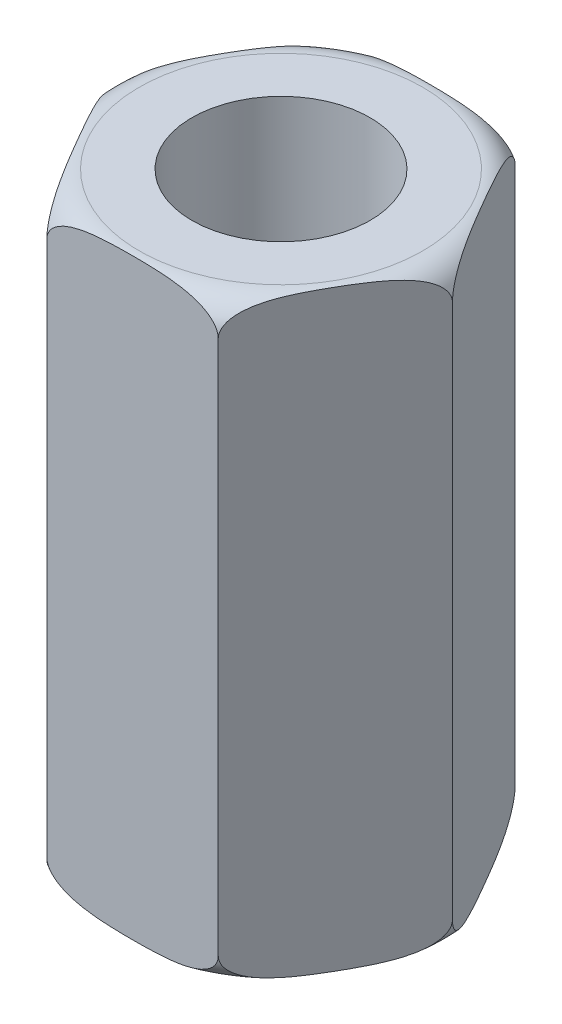
from build123d import *

# Parameters (mm, degrees)
ESQUISSE1_R        = 1.5
BOSS_EXTRU_1_DEPTH = 10


with BuildPart() as part:
    # Esquisse1 → Boss.-Extru.1 (new body)
    with BuildSketch(Plane(origin=(0, 0, 0), x_dir=(1, 0, 0), z_dir=(0, 1, 0))):
        Polygon((2.886751346, 0), (1.443375673, 2.5), (-1.443375673, 2.5), (-2.886751346, 0), (-1.443375673, -2.5), (1.443375673, -2.5), align=None)
        with Locations(Location((0, 0, 0), (0, 0, 270))):
            Circle(ESQUISSE1_R, mode=Mode.SUBTRACT)
    extrude(amount=BOSS_EXTRU_1_DEPTH)

    # Esquisse3 → Enlèvement de matière-Révolution1 (revolve, cut)
    with BuildSketch(Plane.XY, mode=Mode.PRIVATE) as enl_vement_de_mati_re_r_volution1_sk:
        with BuildLine():
            Line((2.386751346, 10), (2.886751346, 10))
            Line((2.886751346, 10), (2.886751346, 9.5))
            ThreePointArc((2.886751346, 9.5), (2.740304737, 9.853553391), (2.386751346, 10))
        make_face()
        with BuildLine():
            Line((2.886751346, 0.5), (2.886751346, 0))
            Line((2.886751346, 0), (2.386751346, 0))
            ThreePointArc((2.386751346, 0), (2.740304737, 0.146446609), (2.886751346, 0.5))
        make_face()
    revolve(enl_vement_de_mati_re_r_volution1_sk.sketch.rotate(Axis((0, -0.5, 0), (0, 1, 0)), 90), axis=Axis((0, -0.5, 0), (0, 1, 0)), mode=Mode.SUBTRACT)


solid = part.part
